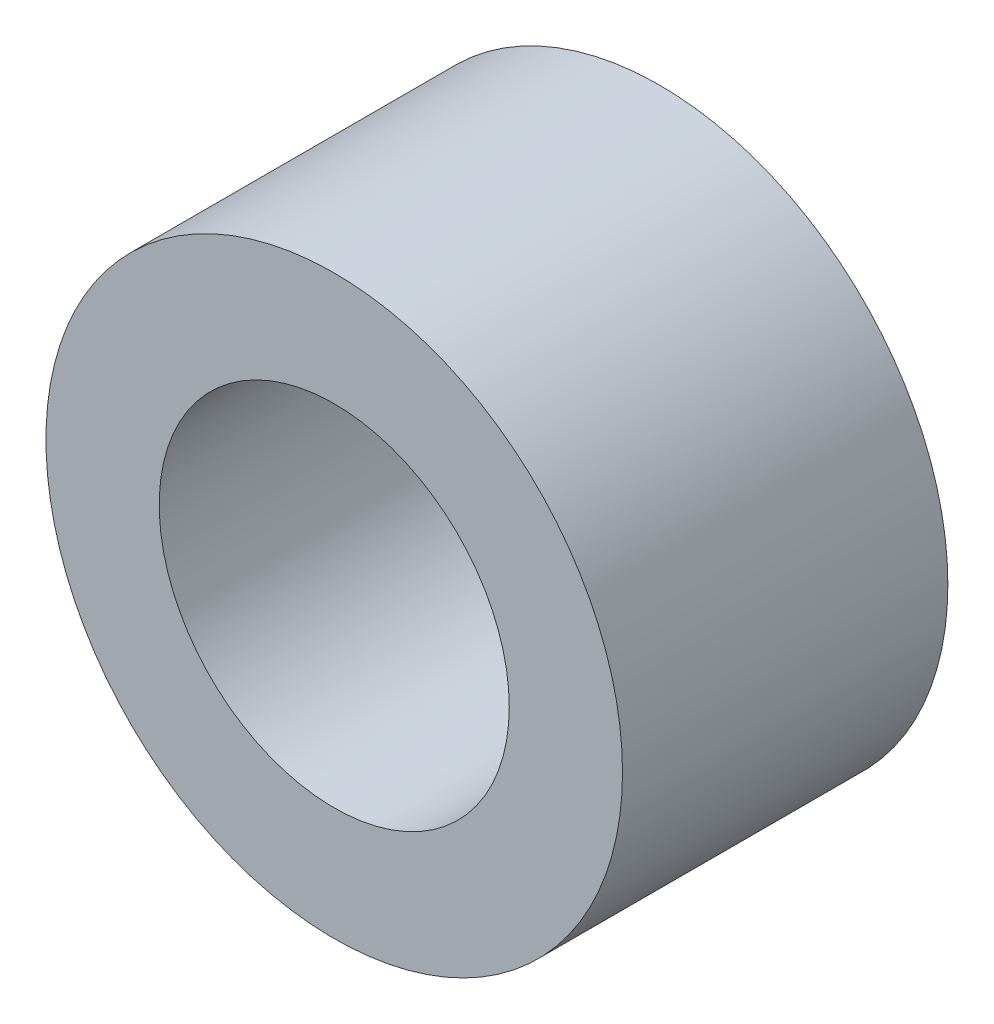
from build123d import *

# Parameters (mm, degrees)
SKETCH2_R           = 7
SKETCH2_R_2         = 4.25
BOSS_EXTRUDE1_DEPTH = 7.9


with BuildPart() as part:
    # Sketch2 → Boss-Extrude1 (new body)
    with BuildSketch(Plane.XY):
        Circle(SKETCH2_R)
        Circle(SKETCH2_R_2, mode=Mode.SUBTRACT)
    extrude(amount=BOSS_EXTRUDE1_DEPTH)


solid = part.part
